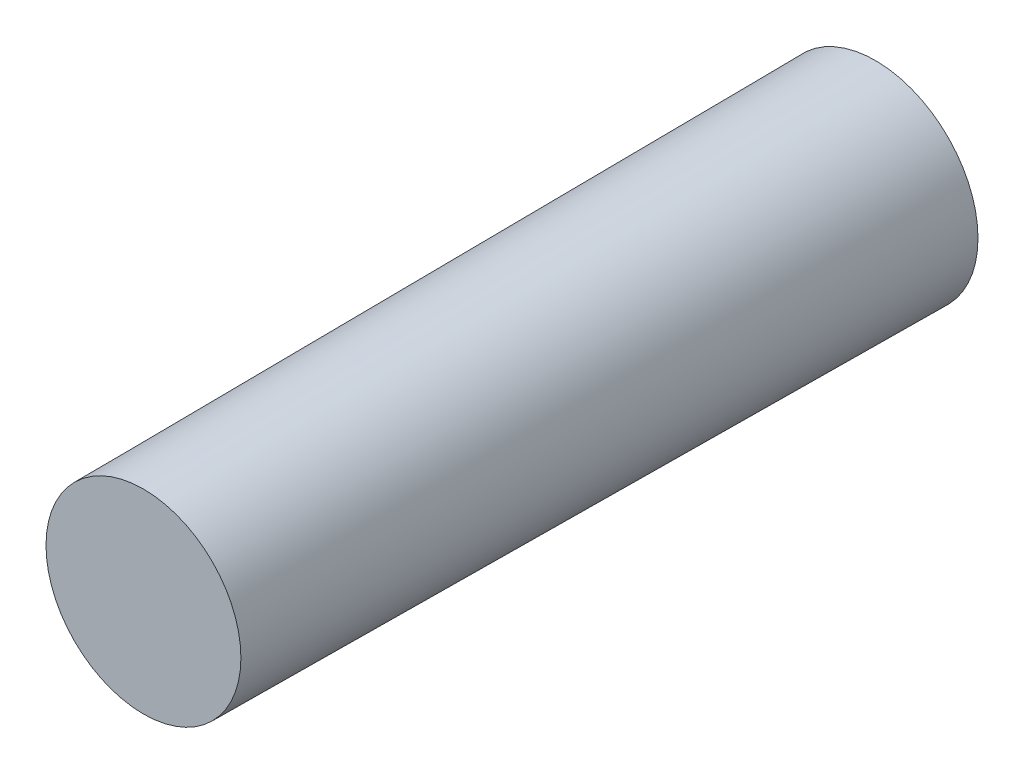
from build123d import *

# Parameters (mm, degrees)
SKETCH1_R           = 7.6835
BOSS_EXTRUDE1_DEPTH = 54.8386
BOSS_EXTRUDE1_TAPER = 0.4


with BuildPart() as part:
    # Sketch1 → Boss-Extrude1 (new body)
    with BuildSketch(Plane.XY):
        Circle(SKETCH1_R)
    extrude(amount=BOSS_EXTRUDE1_DEPTH, taper=BOSS_EXTRUDE1_TAPER)


solid = part.part
